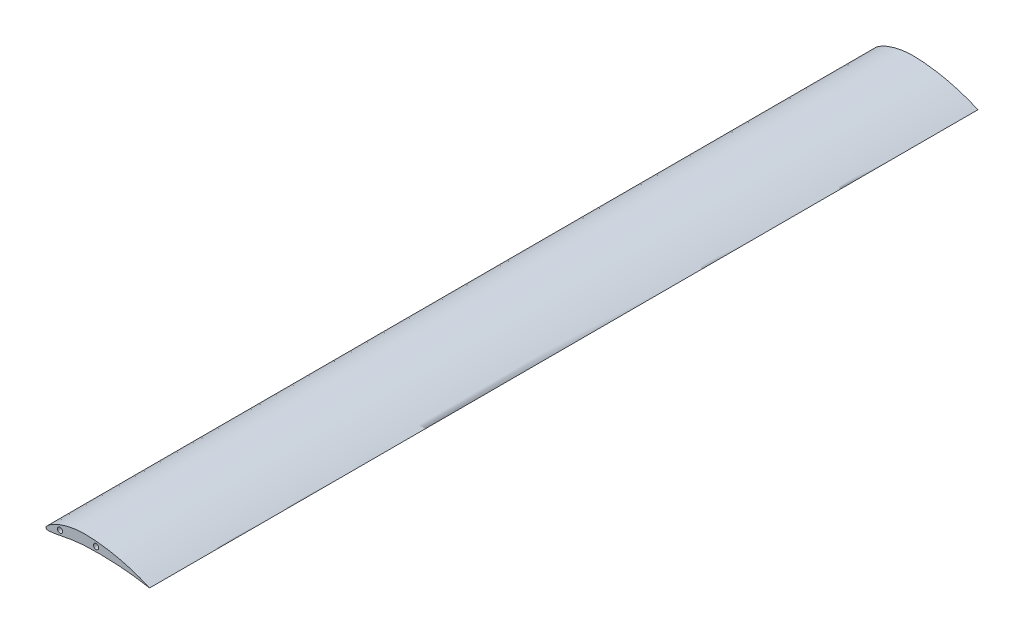
from build123d import *

# Parameters (mm, degrees)
BOSS_EXTRUDE1_DEPTH = 1016
SKETCH3_R           = 3.175
CUT_EXTRUDE1_DEPTH  = 1025.058174048


with BuildPart() as part:
    # Sketch2 → Boss-Extrude1 (new body)
    with BuildSketch(Plane.XY):
        with BuildLine():
            add(Edge.make_bspline(
                [(127, 0), (127.001446741, 0.004853045), (126.738763939, 0.104699091), (126.474753019, 0.230570889), (125.817130693, 0.504147684), (125.001340584, 0.851737477), (123.915893777, 1.303072811), (122.61098458, 1.838608554), (121.073288751, 2.456757509), (119.313870122, 3.148404719), (117.336142205, 3.90504262), (115.147463158, 4.717905515), (112.754834777, 5.57696998), (110.166433494, 6.472194795), (107.391089372, 7.39261069), (104.438678089, 8.328090795), (101.319597345, 9.2675525), (98.045115926, 10.200494518), (94.627212915, 11.116315934), (91.078667421, 12.004960293), (87.412826324, 12.856383394), (83.643786282, 13.661667337), (79.7861261, 14.411854551), (75.855078453, 15.099077594), (71.866392235, 15.716080364), (67.836240585, 16.256434329), (63.781153237, 16.714319579), (59.718102839, 17.086088014), (55.664145869, 17.36631712), (51.605696649, 17.560527057), (47.549732843, 17.641208431), (43.514776724, 17.537789824), (39.553250775, 17.271730683), (35.693210868, 16.84694859), (31.954323104, 16.275779426), (28.355349837, 15.570645769), (24.913989177, 14.747063424), (21.646807086, 13.821197235), (18.569082309, 12.810802546), (15.694255403, 11.735335776), (13.034910844, 10.613079688), (10.60141753, 9.46400509), (8.402904313, 8.306969489), (6.447081503, 7.16004663), (4.739524079, 6.04133261), (3.284955458, 4.966307321), (2.086081584, 3.949367071), (1.143873971, 3.002535435), (0.456720901, 2.134066125), (0.022184988, 1.346475802), (-0.159206007, 0.627366588), (-0.047082873, -0.021223573), (0.362847502, -0.534303323), (1.012892347, -0.879848471), (1.873880522, -1.093210994), (2.952582028, -1.190944566), (4.248166308, -1.181017988), (5.756607825, -1.070160825), (7.471044291, -0.866369076), (9.383333261, -0.579018676), (11.484488904, -0.218438273), (13.765060421, 0.203541056), (16.215255961, 0.674841858), (18.825191736, 1.182465342), (21.584845728, 1.71332049), (24.484476837, 2.253478823), (27.51424682, 2.789566754), (30.664573463, 3.307830016), (33.926048193, 3.79490953), (37.289371025, 4.23758988), (40.745254389, 4.624350205), (44.28447289, 4.941640783), (47.905423101, 5.184211544), (51.6294117, 5.325545025), (55.441708601, 5.423661455), (59.321322546, 5.496033714), (63.22322937, 5.531360699), (67.132995148, 5.528716101), (71.036181686, 5.485697141), (74.918003596, 5.401474424), (78.763580875, 5.27574575), (82.557964752, 5.109812327), (86.286078632, 4.905593302), (89.933039374, 4.665621591), (93.483942738, 4.39366033), (96.924289621, 4.09427858), (100.239598093, 3.771927715), (103.41598132, 3.432411725), (106.439784222, 3.081307643), (109.298006735, 2.724843285), (111.978074349, 2.368796242), (114.468240594, 2.019545387), (116.757258452, 1.682978297), (118.834992524, 1.364850262), (120.691205525, 1.070290344), (122.319472245, 0.80427415), (123.706085778, 0.572434642), (124.861923999, 0.373763816), (125.734848518, 0.225212322), (126.434544293, 0.095489194), (126.724259966, 0.056211425), (126.998552722, -0.004854847), (127, 0)],
                knots=[0, 0, 0, 0, 0.000500326, 0.001999908, 0.004491016, 0.007962981, 0.012400212, 0.017782637, 0.024086033, 0.031283105, 0.039342427, 0.048228584, 0.05790426, 0.068327959, 0.07945652, 0.091243042, 0.103640126, 0.116597604, 0.130063469, 0.14398459, 0.158306115, 0.172972351, 0.18792732, 0.203113116, 0.2184717, 0.233944808, 0.249473445, 0.264998855, 0.280462153, 0.295803845, 0.311323629, 0.326706508, 0.341810405, 0.356582637, 0.370971506, 0.384923777, 0.398386753, 0.411306988, 0.423632654, 0.435311865, 0.446295011, 0.456534872, 0.465987533, 0.47461304, 0.482377355, 0.489253053, 0.495223641, 0.50028594, 0.504461055, 0.507811561, 0.510480594, 0.512762222, 0.515043424, 0.517702037, 0.521013381, 0.525103948, 0.530021122, 0.535771893, 0.542341397, 0.549702684, 0.557818571, 0.566648243, 0.576147104, 0.58626814, 0.596964793, 0.60818991, 0.61989864, 0.632046653, 0.644592154, 0.657497245, 0.670724393, 0.684239663, 0.698010813, 0.712098303, 0.726728066, 0.74149363, 0.756341333, 0.771219325, 0.786072643, 0.800847937, 0.815489998, 0.829943038, 0.844152554, 0.858061386, 0.871615338, 0.88475832, 0.897436299, 0.90959464, 0.921181699, 0.932145359, 0.942436617, 0.952008463, 0.960816148, 0.968817229, 0.975973665, 0.982250118, 0.987615556, 0.992043304, 0.995510912, 0.998000498, 0.999499488, 1, 1, 1, 1], degree=3))
        make_face()
    extrude(amount=BOSS_EXTRUDE1_DEPTH)

    # Sketch3 → Cut-Extrude1 (cut, through all)
    with BuildSketch(Plane.XY.offset(1016)):
        with Locations((17.118328654, 6.350455264)):
            Circle(SKETCH3_R)
        with Locations((61.303160175, 11.198461397)):
            Circle(SKETCH3_R)
    extrude(amount=-CUT_EXTRUDE1_DEPTH, mode=Mode.SUBTRACT)


solid = part.part
